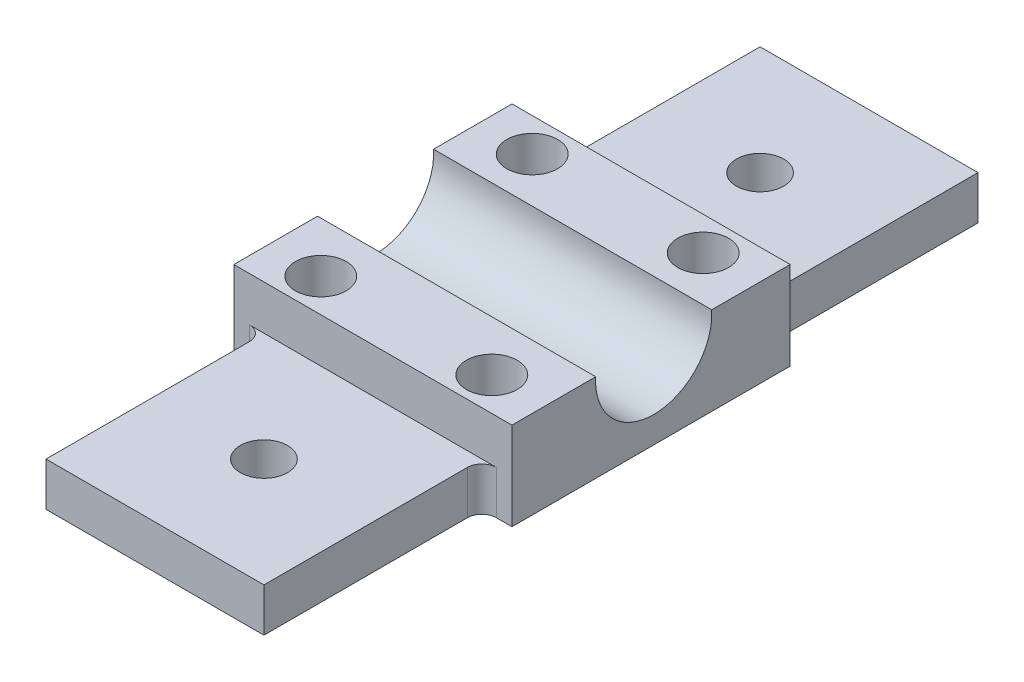
from build123d import *

# Parameters (mm, degrees)
SKETCH1_W                            = 38.29
SKETCH1_H                            = 38.3
BOSS_EXTRUDE1_DEPTH                  = 12.12
SKETCH2_R                            = 8
CUT_EXTRUDE1_DEPTH                   = 45.494280531
M8X1_0_TAPPED_HOLE2_D                = 7
MIRROR1_AT_THE_SECOND_PLANE_COPY_1_D = 7
SKETCH9_W                            = 30
SKETCH9_H                            = 30
SKETCH9_R                            = 3.25
BOSS_EXTRUDE2_DEPTH                  = 6
FILLET1_R                            = 2


with BuildPart() as part:
    # Sketch1 → Boss-Extrude1 (new body)
    with BuildSketch(Plane(origin=(0, 0, 0), x_dir=(1, 0, 0), z_dir=(0, 1, 0))):
        Rectangle(SKETCH1_W, SKETCH1_H)
    extrude(amount=BOSS_EXTRUDE1_DEPTH)

    # Sketch2 → Cut-Extrude1 (cut, through all)
    with BuildSketch(Plane(origin=(19.145, 0, 0), x_dir=(0, 0, -1), z_dir=(1, 0, 0))):
        with Locations((0.363834185, 11.62)):
            Circle(SKETCH2_R)
    extrude(amount=-CUT_EXTRUDE1_DEPTH, mode=Mode.SUBTRACT)

    # M8x1.0 Tapped Hole2 (through all)
    with Locations(Plane(origin=(0, 12.12, 0), x_dir=(1, 0, 0), z_dir=(0, 1, 0))):
        with Locations((-11.77, 14.55), (11.77, 14.55), (-11.77, -14.55), (11.77, -14.55)):
            m8x1_0_tapped_hole2 = Hole(M8X1_0_TAPPED_HOLE2_D / 2)

    # Mirror1: M8x1.0 Tapped Hole2 across plane
    add(m8x1_0_tapped_hole2.mirror(Plane.XY), mode=Mode.SUBTRACT)

    # Mirror1 at the second plane: M8x1.0 Tapped Hole2 across plane
    add(m8x1_0_tapped_hole2.mirror(Plane(origin=(0, 0, 0), x_dir=(0, 0, 1), z_dir=(1, 0, 0))), mode=Mode.SUBTRACT)

    # Mirror1 at the second plane copy 1 (through all)
    with Locations(Plane(origin=(0, 12.12, 0), x_dir=(-1, 0, 0), z_dir=(0, 1, 0))):
        with Locations((-11.77, 14.55), (11.77, 14.55), (-11.77, -14.55), (11.77, -14.55)):
            Hole(MIRROR1_AT_THE_SECOND_PLANE_COPY_1_D / 2)

    # Sketch9 → Boss-Extrude2 (add)
    with BuildSketch(Plane.XZ):
        with Locations((0, -34.15)):
            Rectangle(SKETCH9_W, SKETCH9_H)
        with Locations(Location((0, -34.15, 0), (0, 0, 270))):
            Circle(SKETCH9_R, mode=Mode.SUBTRACT)
    boss_extrude2 = extrude(amount=-BOSS_EXTRUDE2_DEPTH)

    # Mirror2: Boss-Extrude2 across plane
    add(boss_extrude2.mirror(Plane.XY))

    # Fillet1
    fillet1_edges = [part.edges().sort_by_distance(p)[0] for p in [
        (15, 3, 19.15),
        (-15, 3, 19.15),
        (15, 3, -19.15),
        (-15, 3, -19.15),
    ]]
    fillet(fillet1_edges, radius=FILLET1_R)


solid = part.part
